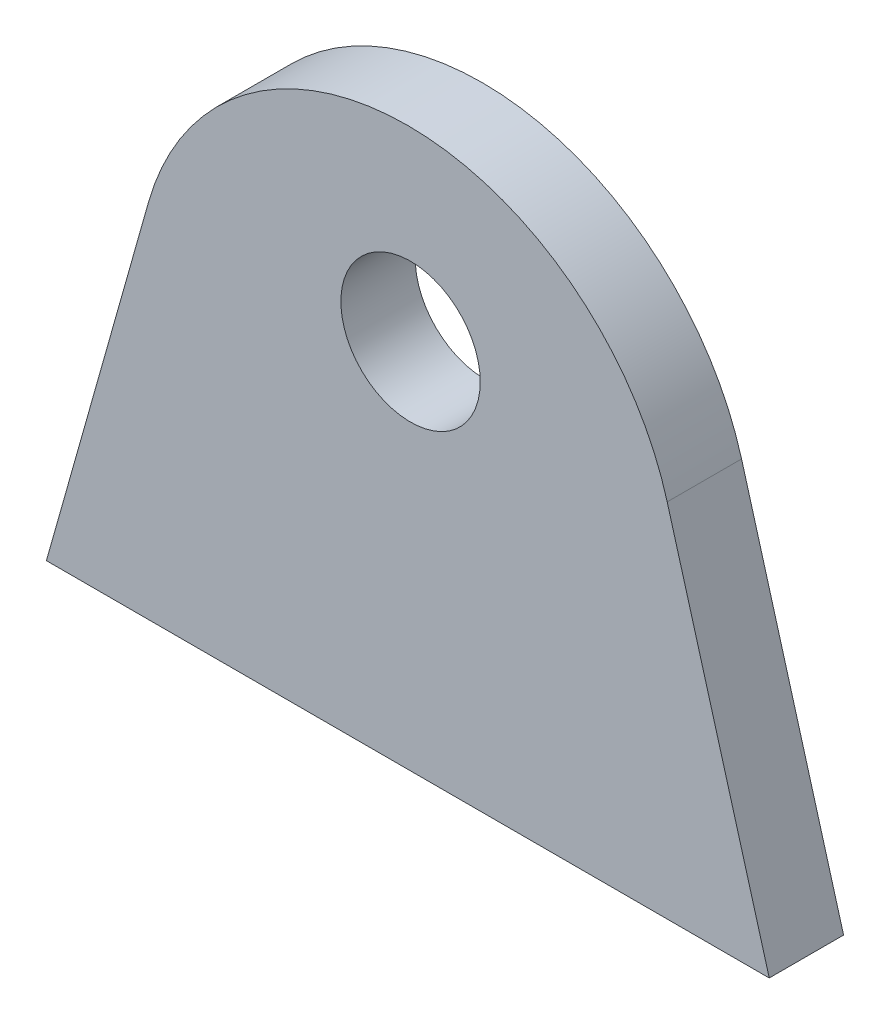
from build123d import *

# Parameters (mm, degrees)
SKETCH1_R           = 2.38125
BOSS_EXTRUDE1_DEPTH = 2.54


with BuildPart() as part:
    # Sketch1 → Boss-Extrude1 (new body)
    with BuildSketch(Plane.XY):
        with BuildLine():
            Line((0, 0), (24.69507233, 0))
            Line((24.69507233, 0), (21.208982912, 12.344461037))
            ThreePointArc((21.208982912, 12.344461037), (12.347536165, 19.05), (3.486089418, 12.344461037))
            Line((3.486089418, 12.344461037), (0, 0))
        make_face()
        with Locations((12.440745692, 12.699657948)):
            Circle(SKETCH1_R, mode=Mode.SUBTRACT)
    extrude(amount=BOSS_EXTRUDE1_DEPTH)


solid = part.part
